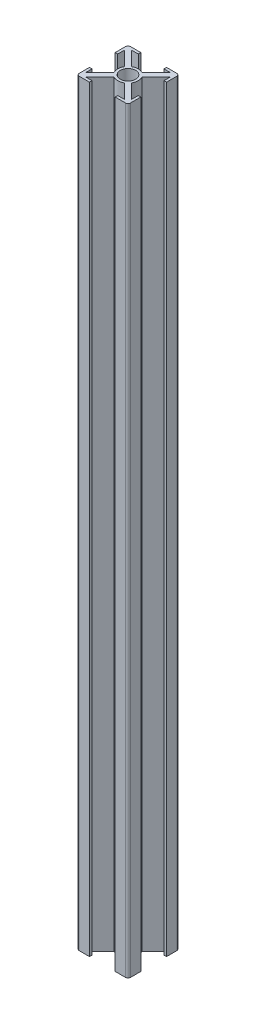
from build123d import *

# Parameters (mm, degrees)
ESQUISSE1_R        = 3
BOSS_EXTRU_1_DEPTH = 295
CONG_1_R           = 1


with BuildPart() as part:
    # Esquisse1 → Boss.-Extru.1 (new body)
    with BuildSketch(Plane(origin=(0, 0, 0), x_dir=(1, 0, 0), z_dir=(0, 1, 0))):
        with BuildLine():
            Line((-9, 7.585786438), (-3.445719569, 2.031506006))
            ThreePointArc((-3.445719569, 2.031506006), (-4, 0), (-3.445719569, -2.031506006))
            Line((-3.445719569, -2.031506006), (-9, -7.585786438))
            Line((-9, -7.585786438), (-9, -5))
            Line((-9, -5), (-10, -5))
            Line((-10, -5), (-10, -10))
            Line((-10, -10), (-5, -10))
            Line((-5, -10), (-5, -9))
            Line((-5, -9), (-7.585786438, -9))
            Line((-7.585786438, -9), (-2.031506006, -3.445719569))
            ThreePointArc((-2.031506006, -3.445719569), (0, -4), (2.031506006, -3.445719569))
            Line((2.031506006, -3.445719569), (7.585786438, -9))
            Line((7.585786438, -9), (5, -9))
            Line((5, -9), (5, -10))
            Line((5, -10), (10, -10))
            Line((10, -10), (10, -5))
            Line((10, -5), (9, -5))
            Line((9, -5), (9, -7.585786438))
            Line((9, -7.585786438), (3.445719569, -2.031506006))
            ThreePointArc((3.445719569, -2.031506006), (4, 0), (3.445719569, 2.031506006))
            Line((3.445719569, 2.031506006), (9, 7.585786438))
            Line((9, 7.585786438), (9, 5))
            Line((9, 5), (10, 5))
            Line((10, 5), (10, 10))
            Line((10, 10), (5, 10))
            Line((5, 10), (5, 9))
            Line((5, 9), (7.585786438, 9))
            Line((7.585786438, 9), (2.031506006, 3.445719569))
            ThreePointArc((2.031506006, 3.445719569), (0, 4), (-2.031506006, 3.445719569))
            Line((-2.031506006, 3.445719569), (-7.585786438, 9))
            Line((-7.585786438, 9), (-5, 9))
            Line((-5, 9), (-5, 10))
            Line((-5, 10), (-10, 10))
            Line((-10, 10), (-10, 5))
            Line((-10, 5), (-9, 5))
            Line((-9, 5), (-9, 7.585786438))
        make_face()
        with Locations(Location((0, 0, 0), (0, 0, 270))):
            Circle(ESQUISSE1_R, mode=Mode.SUBTRACT)
    extrude(amount=BOSS_EXTRU_1_DEPTH)

    # Congé1
    cong_1_edges = [part.edges().sort_by_distance(p)[0] for p in [
        (-10, 147.5, -10),
        (10, 147.5, -10),
        (10, 147.5, 10),
        (-10, 147.5, 10),
    ]]
    fillet(cong_1_edges, radius=CONG_1_R)


solid = part.part
